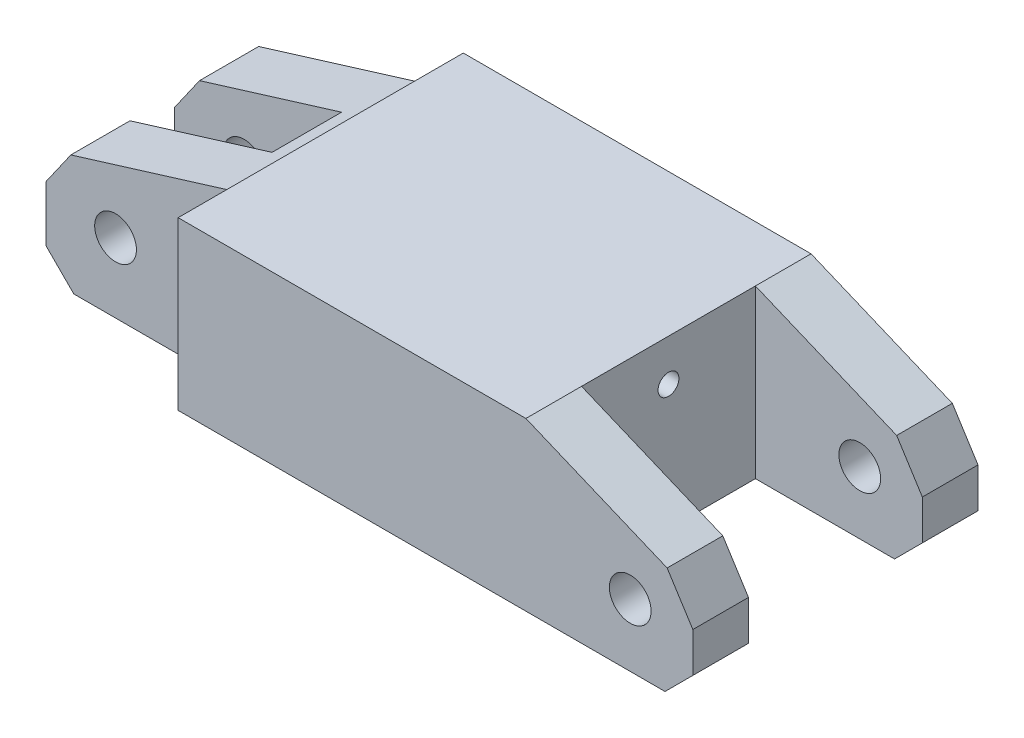
from build123d import *
from OCP.BRepFilletAPI import BRepFilletAPI_MakeChamfer

# Parameters (mm, degrees)
SKETCH_2_W            = 20.5
SKETCH_2_H            = 12
EXTRUDE_1_DEPTH       = 50
SKETCH_3_W            = 24
SKETCH_3_H            = 5
CUT_EXTRUDE_1_DEPTH   = 53.431502935
SKETCH_5_W            = 13.122567423
SKETCH_5_H            = 12.5
CUT_EXTRUDE_2_DEPTH   = 53.431502935
SKETCH_7_R            = 0.75
CUT_EXTRUDE_3_DEPTH   = 40.812843405
SKETCH_10_W           = 19.106520138
SKETCH_10_H           = 8.700699496
CUT_EXTRUDE_3_2_DEPTH = 53.431502935
SKETCH_11_R           = 1.5
CUT_EXTRUDE_6_DEPTH   = 54.150729064
SKETCH_9_R            = 1.5
CUT_EXTRUDE_5_DEPTH   = 55.371407927
SKETCH_12_R           = 0.75
CUT_EXTRUDE_4_DEPTH   = 12
CUT_EXTRUDE_7_DEPTH   = 55.371407927
CHAMFER_5_SIZE        = 2
CHAMFER_6_SIZE        = 2
CHAMFER_6_SIZE2       = 1.867573994
CHAMFER_6_SIZE2_2     = 2.1420728
SKETCH_14_R           = 0.75
CUT_EXTRUDE_5_2_DEPTH = 6
CUT_EXTRUDE_8_DEPTH   = 10
SKETCH_16_R           = 0.75
CUT_EXTRUDE_9_DEPTH   = 5


with BuildPart() as part:
    # Эскиз2 → Вытянуть1 (new body)
    with BuildSketch(Plane(origin=(0, 0, 0), x_dir=(0, 0, -1), z_dir=(1, 0, 0))):
        Rectangle(SKETCH_2_W, SKETCH_2_H)
    extrude(amount=EXTRUDE_1_DEPTH)

    # Эскиз3 → Вырез-Вытянуть1 (cut, through all)
    with BuildSketch(Plane(origin=(0, 6, 0), x_dir=(1, 0, 0), z_dir=(0, 1, 0))):
        Rectangle(SKETCH_3_W, SKETCH_3_H)
    extrude(amount=-CUT_EXTRUDE_1_DEPTH, mode=Mode.SUBTRACT)

    # Эскиз5 → Вырез-Вытянуть2 (cut, through all)
    with BuildSketch(Plane(origin=(0, 6, 0), x_dir=(1, 0, 0), z_dir=(0, 1, 0))):
        with Locations((44.561283712, 0)):
            Rectangle(SKETCH_5_W, SKETCH_5_H)
    extrude(amount=-CUT_EXTRUDE_2_DEPTH, mode=Mode.SUBTRACT)

    # Эскиз7 → Cut-Extrude 3 (cut, through all)
    with BuildSketch(Plane(origin=(38, 0, 0), x_dir=(0, 0, -1), z_dir=(1, 0, 0))):
        with Locations((0, 3)):
            Circle(SKETCH_7_R)
    extrude(amount=-CUT_EXTRUDE_3_DEPTH, mode=Mode.SUBTRACT)

    # Эскиз10 → Cut-Extrude 3 2 (cut, through all)
    with BuildSketch(Plane(origin=(0, 6, 0), x_dir=(1, 0, 0), z_dir=(0, 1, 0))):
        with Locations((3.446739931, 11.100349748)):
            Rectangle(SKETCH_10_W, SKETCH_10_H)
        with Locations((3.446739931, -11.100349748)):
            Rectangle(SKETCH_10_W, SKETCH_10_H)
    extrude(amount=-CUT_EXTRUDE_3_2_DEPTH, mode=Mode.SUBTRACT)

    # Эскиз11 → Вытянуть6 (cut, through all)
    with BuildSketch(Plane.XY.offset(6.75)):
        with Locations((5, -1)):
            Circle(SKETCH_11_R)
    extrude(amount=-CUT_EXTRUDE_6_DEPTH, mode=Mode.SUBTRACT)

    # Эскиз9 → Cut-Extrude 5 (cut, through all)
    with BuildSketch(Plane.XY.offset(10.25)):
        with Locations((45.5, -1.5)):
            Circle(SKETCH_9_R)
    extrude(amount=-CUT_EXTRUDE_5_DEPTH, mode=Mode.SUBTRACT)

    # Эскиз12 → Вырез-Вытянуть4 (cut)
    with BuildSketch(Plane.ZY.offset(-12)):
        with Locations((-1.791386219, -3.407348241)):
            Circle(SKETCH_12_R)
    extrude(amount=-CUT_EXTRUDE_4_DEPTH, mode=Mode.SUBTRACT)

    # Эскиз13 → Вытянуть7 (cut, through all)
    with BuildSketch(Plane.XY.offset(10.25)):
        Polygon((13, 6), (0, 6), (0, 2), align=None)
        Polygon((50, 6), (50, 1), (38, 6), align=None)
    extrude(amount=-CUT_EXTRUDE_7_DEPTH, mode=Mode.SUBTRACT)

    # Фаска5
    chamfer_5_edges = [part.edges().sort_by_distance(p)[0] for p in [
        (50, -6, 8.25),
        (0, -6, -4.625),
        (50, -6, -8.25),
        (0, -6, 4.625),
    ]]
    chamfer(chamfer_5_edges, length=CHAMFER_5_SIZE)

    # Фаска6: one chamfer whose edges measure the first distance from different faces: ONE call of the kernel's chamfer builder (chamfer() names one face for all edges)
    chamfer_6_edges_1 = [part.edges().sort_by_distance(p)[0] for p in [
        (0, 2, 4.625),
    ]]
    chamfer_6_side_1 = [part.faces().sort_by_distance(p)[0] for p in [
        (0, -1, 4.625),
    ]]
    chamfer_6_edges_2 = [part.edges().sort_by_distance(p)[0] for p in [
        (0, 2, -4.625),
    ]]
    chamfer_6_side_2 = [part.faces().sort_by_distance(p)[0] for p in [
        (0, -1, -4.625),
    ]]
    chamfer_6_edges_3 = [part.edges().sort_by_distance(p)[0] for p in [
        (50, 1, 8.25),
    ]]
    chamfer_6_side_3 = [part.faces().sort_by_distance(p)[0] for p in [
        (44, 3.5, 8.25),
    ]]
    chamfer_6_edges_4 = [part.edges().sort_by_distance(p)[0] for p in [
        (50, 1, -8.25),
    ]]
    chamfer_6_side_4 = [part.faces().sort_by_distance(p)[0] for p in [
        (44, 3.5, -8.25),
    ]]
    chamfer_6 = BRepFilletAPI_MakeChamfer(part.part.solid().wrapped)
    for e in chamfer_6_edges_1:
        chamfer_6.Add(CHAMFER_6_SIZE, CHAMFER_6_SIZE2, e.wrapped, chamfer_6_side_1[0].wrapped)  # the first distance lies on this face
    for e in chamfer_6_edges_2:
        chamfer_6.Add(CHAMFER_6_SIZE, CHAMFER_6_SIZE2, e.wrapped, chamfer_6_side_2[0].wrapped)  # the first distance lies on this face
    for e in chamfer_6_edges_3:
        chamfer_6.Add(CHAMFER_6_SIZE, CHAMFER_6_SIZE2_2, e.wrapped, chamfer_6_side_3[0].wrapped)  # the first distance lies on this face
    for e in chamfer_6_edges_4:
        chamfer_6.Add(CHAMFER_6_SIZE, CHAMFER_6_SIZE2_2, e.wrapped, chamfer_6_side_4[0].wrapped)  # the first distance lies on this face
    add(Compound.cast(chamfer_6.Shape()), mode=Mode.REPLACE)

    # Эскиз14 → Cut-Extrude 5 2 (cut)
    with BuildSketch(Plane(origin=(38, 0, 0), x_dir=(0, 0, -1), z_dir=(1, 0, 0))):
        with Locations((-2, -3.75)):
            Circle(SKETCH_14_R)
    extrude(amount=-CUT_EXTRUDE_5_2_DEPTH, mode=Mode.SUBTRACT)

    # Эскиз15 → Вытянуть8 (cut)
    with BuildSketch(Plane.XZ.offset(6)):
        with BuildLine():
            Line((18, 6.25), (32, 6.25))
            ThreePointArc((32, 6.25), (34.121320344, 5.371320344), (35, 3.25))
            Line((35, 3.25), (35, -3.25))
            ThreePointArc((35, -3.25), (34.121320344, -5.371320344), (32, -6.25))
            Line((32, -6.25), (18, -6.25))
            ThreePointArc((18, -6.25), (15.878679656, -5.371320344), (15, -3.25))
            Line((15, -3.25), (15, 3.25))
            ThreePointArc((15, 3.25), (15.878679656, 5.371320344), (18, 6.25))
        make_face()
    extrude(amount=-CUT_EXTRUDE_8_DEPTH, mode=Mode.SUBTRACT)

    # Эскиз16 → Вытянуть9 (cut)
    with BuildSketch(Plane.ZY.offset(-12)):
        with Locations((1.748401574, 3.000943563)):
            Circle(SKETCH_16_R)
    extrude(amount=-CUT_EXTRUDE_9_DEPTH, mode=Mode.SUBTRACT)


solid = part.part
